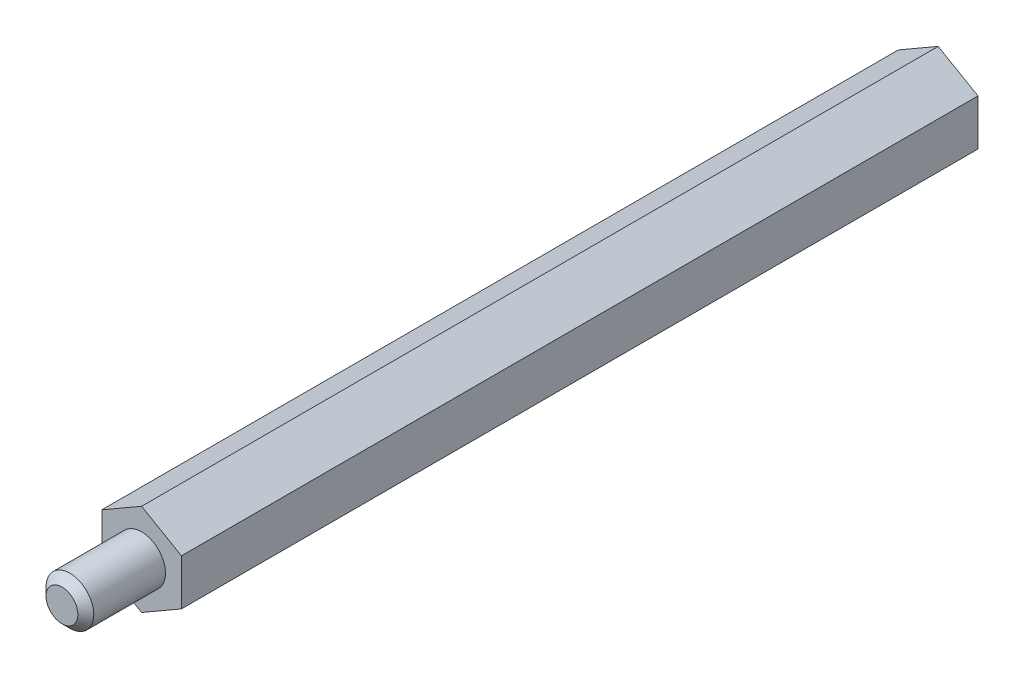
from build123d import *

# Parameters (mm, degrees)
BOSS_EXTRU_1_DEPTH      = 50
ESQUISSE2_R             = 1.5
BOSS_EXTRU_2_DEPTH      = 5
ESQUISSE3_R             = 1.25
ENL_V_MAT_EXTRU_1_DEPTH = 10
CHANFREIN1_SIZE         = 0.5


with BuildPart() as part:
    # Esquisse1 → Boss.-Extru.1 (new body)
    with BuildSketch(Plane.XY):
        Polygon((2.5, -1.443375673), (2.5, 1.443375673), (0, 2.886751346), (-2.5, 1.443375673), (-2.5, -1.443375673), (0, -2.886751346), align=None)
    extrude(amount=BOSS_EXTRU_1_DEPTH)

    # Esquisse2 → Boss.-Extru.2 (add)
    with BuildSketch(Plane.XY.offset(50)):
        Circle(ESQUISSE2_R)
    extrude(amount=BOSS_EXTRU_2_DEPTH)

    # Esquisse3 → Enlèv. mat.-Extru.1 (cut)
    with BuildSketch(Plane(origin=(0, 0, 0), x_dir=(-1, 0, 0), z_dir=(0, 0, -1))):
        Circle(ESQUISSE3_R)
    extrude(amount=-ENL_V_MAT_EXTRU_1_DEPTH, mode=Mode.SUBTRACT)

    # Chanfrein1
    chanfrein1_edges = [part.edges().sort_by_distance(p)[0] for p in [
        (-1.5, 0, 55),
    ]]
    chamfer(chanfrein1_edges, length=CHANFREIN1_SIZE)


solid = part.part
